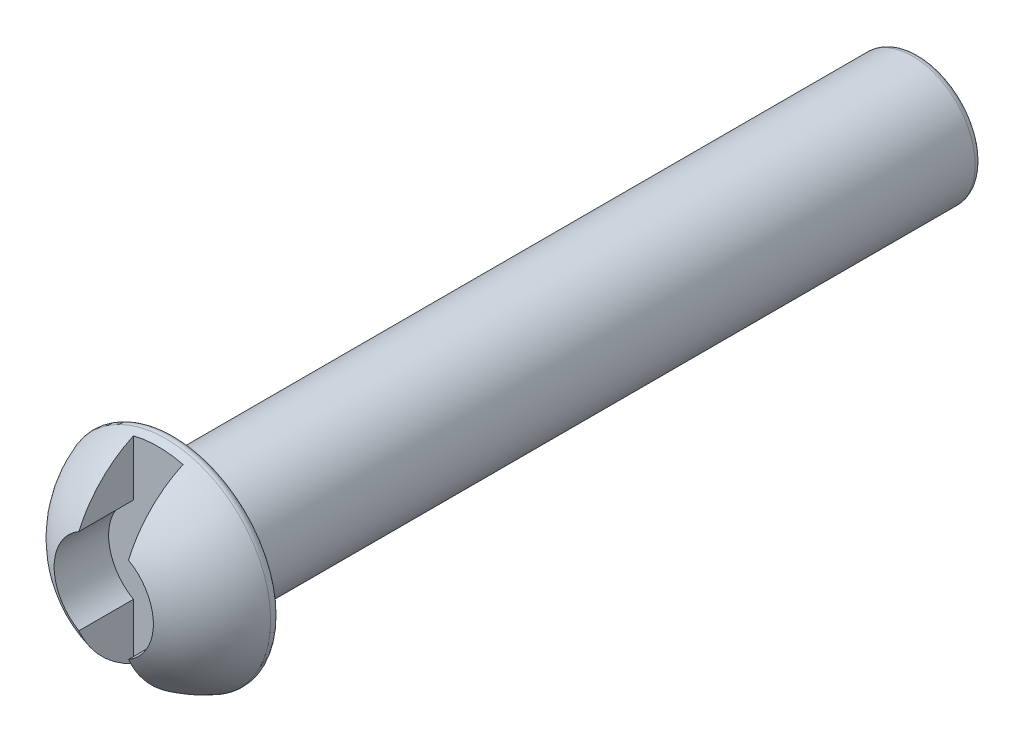
from build123d import *

# Parameters (mm, degrees)
CUT_EXTRUDE1_DEPTH = 1
FILLET1_R          = 0.1


with BuildPart() as part:
    # Sketch2 → Revolve1 (revolve)
    with BuildSketch(Plane(origin=(0, 0, 0), x_dir=(0, 0, -1), z_dir=(1, 0, 0))):
        with BuildLine():
            Line((0, 0), (12.5, 0))
            Line((12.5, 0), (12.5, 0.95))
            Line((12.5, 0.95), (1.25, 0.95))
            Line((1.25, 0.95), (1.25, 1.625))
            ThreePointArc((1.25, 1.625), (0.348650918, 1.025076217), (0, 0))
        make_face()
    revolve(axis=Axis((0, 0, 0), (0, 0, -1)))

    # Sketch3 → Cut-Extrude1 (cut)
    with BuildSketch(Plane.XY):
        with BuildLine():
            Line((0.375, 0.649519053), (0.375, 2.046773305))
            Line((0.375, 2.046773305), (-0.375, 2.046773305))
            Line((-0.375, 2.046773305), (-0.375, 0.649519053))
            ThreePointArc((-0.375, 0.649519053), (-0.75, 0), (-0.375, -0.649519053))
            Line((-0.375, -0.649519053), (-0.375, -2.046773305))
            Line((-0.375, -2.046773305), (0.375, -2.046773305))
            Line((0.375, -2.046773305), (0.375, -0.649519053))
            ThreePointArc((0.375, -0.649519053), (0.75, 0), (0.375, 0.649519053))
        make_face()
    extrude(amount=-CUT_EXTRUDE1_DEPTH, mode=Mode.SUBTRACT)

    # Fillet1
    fillet1_edges = [part.edges().sort_by_distance(p)[0] for p in [
        (0, -0.95, -12.5),
        (0, -1.625, -1.25),
    ]]
    fillet(fillet1_edges, radius=FILLET1_R)


solid = part.part
